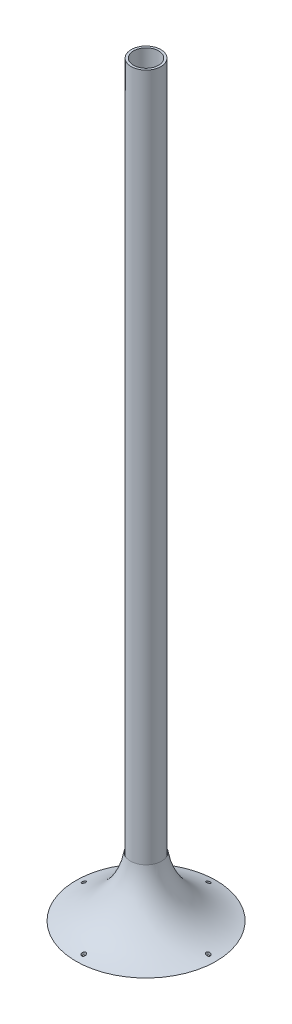
from build123d import *

# Parameters (mm, degrees)
SKETCH1_R           = 24.13
SKETCH1_R_2         = 20.447
BOSS_EXTRUDE1_DEPTH = 1219.2
SKETCH3_R           = 3.2385
CUT_EXTRUDE1_DEPTH  = 1219.2


with BuildPart() as part:
    # Sketch1 → Boss-Extrude1 (new body)
    with BuildSketch(Plane(origin=(0, 0, 0), x_dir=(1, 0, 0), z_dir=(0, 1, 0))):
        with Locations(Location((0, 0, 0), (0, 0, 90))):
            Circle(SKETCH1_R)
        with Locations(Location((0, 0, 0), (0, 0, 90))):
            Circle(SKETCH1_R_2, mode=Mode.SUBTRACT)
    extrude(amount=BOSS_EXTRUDE1_DEPTH)


with BuildPart() as body_2:
    # Sketch2 → Revolve2 (revolve)
    with BuildSketch(Plane.XY):
        with BuildLine():
            Line((25.4, 97.068926284), (25.4, 0))
            Line((25.4, 0), (114.3, 0))
            ThreePointArc((114.3, 0), (54.98641701, 34.921738881), (25.4, 97.068926284))
        make_face()
    revolve(axis=Axis((0, 0, 0), (0, 1, 0)))

    # Sketch3 → Cut-Extrude1 (cut)
    with BuildSketch(Plane.XZ):
        with Locations((0, 101.6)):
            Circle(SKETCH3_R)
        with Locations((101.6, 0)):
            Circle(SKETCH3_R)
        with Locations((0, -101.6)):
            Circle(SKETCH3_R)
        with Locations((-101.6, 0)):
            Circle(SKETCH3_R)
    extrude(amount=-CUT_EXTRUDE1_DEPTH, mode=Mode.SUBTRACT)


solid = Compound([part.part, body_2.part])
